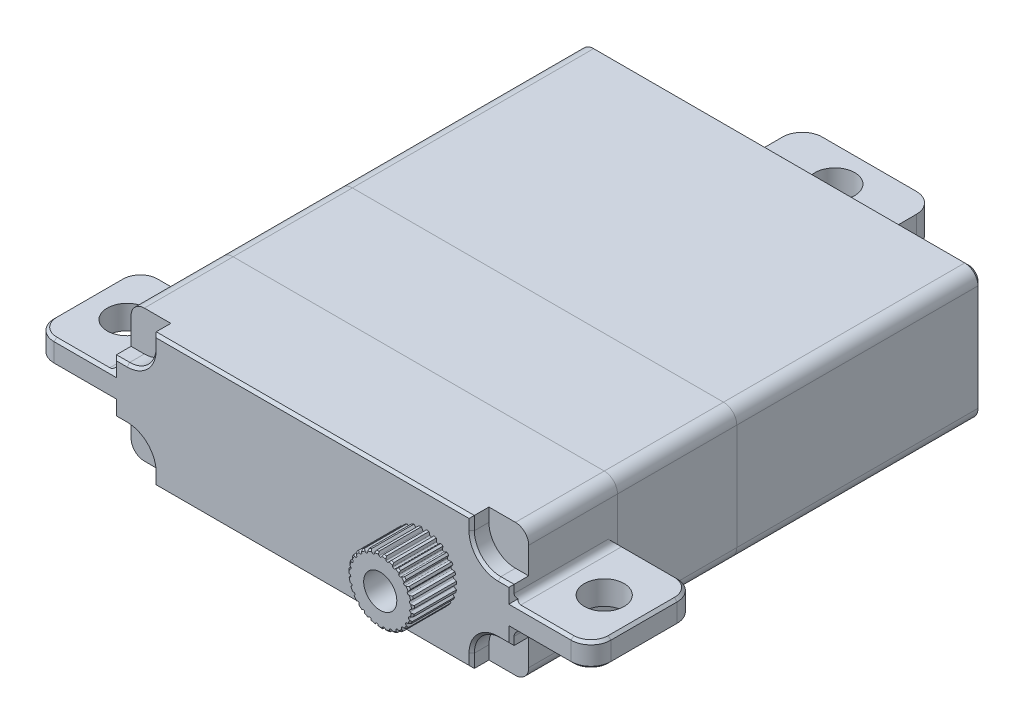
from build123d import *

# Parameters (mm, degrees)
SKETCH1_W                = 30
SKETCH1_H                = 35.5
BOSS_EXTRUDE1_DEPTH      = 10
SKETCH2_W                = 10.1
SKETCH2_H                = 2.1
BOSS_EXTRUDE2_DEPTH      = 6.5
SKETCH3_R                = 1.5
CUT_EXTRUDE1_DEPTH       = 6.5
FILLET1_R                = 1.5
BOSS_EXTRUDE3_DEPTH      = 0.9
BOSS_EXTRUDE3_DEPTH_BACK = 0.9
SKETCH4_W                = 6
SKETCH4_H                = 8
SKETCH4_R                = 1.5
FILLET2_R                = 1.5
SKETCH5_R                = 2.125
BOSS_EXTRUDE4_DEPTH      = 3.3
BOSS_EXTRUDE5_START      = -3.3
SKETCH6_R                = 2.125
BOSS_EXTRUDE5_DEPTH      = 3.3
SKETCH7_R                = 1.25
CUT_EXTRUDE2_DEPTH       = 3.3
CUT_EXTRUDE3_DEPTH       = 1.3
FILLET3_R                = 1
CHAMFER1_SIZE            = 0.3
CHAMFER2_SIZE            = 0.2
FILLET4_R                = 0.5


with BuildPart() as part:
    # Sketch1 → Boss-Extrude1 (new body)
    with BuildSketch(Plane(origin=(0, 0, 0), x_dir=(1, 0, 0), z_dir=(0, 1, 0))):
        Rectangle(SKETCH1_W, SKETCH1_H)
    extrude(amount=BOSS_EXTRUDE1_DEPTH)

    # Sketch2 → Boss-Extrude2 (add)
    with BuildSketch(Plane(origin=(0, 0, -17.75), x_dir=(-1, 0, 0), z_dir=(0, 0, -1))):
        with Locations((0, 5)):
            Rectangle(SKETCH2_W, SKETCH2_H)
    extrude(amount=BOSS_EXTRUDE2_DEPTH)

    # Sketch3 → Cut-Extrude1 (cut)
    with BuildSketch(Plane(origin=(0, 6.05, 0), x_dir=(1, 0, 0), z_dir=(0, 1, 0))):
        with Locations((0, 21.65)):
            Circle(SKETCH3_R)
    extrude(amount=-CUT_EXTRUDE1_DEPTH, mode=Mode.SUBTRACT)

    # Fillet1
    fillet1_edges = [part.edges().sort_by_distance(p)[0] for p in [
        (-5.05, 5, -24.25),
        (5.05, 5, -24.25),
    ]]
    fillet(fillet1_edges, radius=FILLET1_R)

    # Sketch4 → Boss-Extrude3 (add, two sides: drawn at the far end of the back side and taken through both)
    # profile 1 of 2: a face of its own
    with BuildSketch(Plane(origin=(0, 5, 0), x_dir=(1, 0, 0), z_dir=(0, 1, 0)).offset(-BOSS_EXTRUDE3_DEPTH_BACK)):
        with Locations((18, -13.75)):
            Rectangle(SKETCH4_W, SKETCH4_H)
        with Locations((18, -13.75)):
            Circle(SKETCH4_R, mode=Mode.SUBTRACT)
    # profile 2 of 2: a face of its own
    with BuildSketch(Plane(origin=(0, 5, 0), x_dir=(1, 0, 0), z_dir=(0, 1, 0)).offset(-BOSS_EXTRUDE3_DEPTH_BACK)):
        with Locations((-18, -13.75)):
            Rectangle(SKETCH4_W, SKETCH4_H)
        with Locations((-18, -13.75)):
            Circle(SKETCH4_R, mode=Mode.SUBTRACT)
    extrude(amount=BOSS_EXTRUDE3_DEPTH + BOSS_EXTRUDE3_DEPTH_BACK)

    # Fillet2
    fillet2_edges = [part.edges().sort_by_distance(p)[0] for p in [
        (-21, 5, 9.75),
        (-21, 5, 17.75),
        (21, 5, 17.75),
        (21, 5, 9.75),
    ]]
    fillet(fillet2_edges, radius=FILLET2_R)

    # Sketch5 → Boss-Extrude4 (add)
    with BuildSketch(Plane.XY.offset(17.75)):
        with Locations((8.4, 5)):
            Circle(SKETCH5_R)
    extrude(amount=BOSS_EXTRUDE4_DEPTH)

    # Sketch6 → Boss-Extrude5 (add)
    with BuildSketch(Plane.XY.offset(21.05).offset(BOSS_EXTRUDE5_START)):
        with BuildLine():
            Line((8.48660254, 7.275), (8.594746406, 7.46231067))
            ThreePointArc((8.594746406, 7.46231067), (8.686749498, 7.453298744), (8.778350928, 7.44085038))
            Line((8.778350928, 7.44085038), (8.840382948, 7.233649001))
            ThreePointArc((8.840382948, 7.233649001), (8.913120312, 7.165024837), (9.008919264, 7.19370516))
            Line((9.008919264, 7.19370516), (9.157344911, 7.351027155))
            ThreePointArc((9.157344911, 7.351027155), (9.244789754, 7.321040773), (9.331051265, 7.287803213))
            Line((9.331051265, 7.287803213), (9.343627278, 7.071881406))
            ThreePointArc((9.343627278, 7.071881406), (9.398578176, 6.988332625), (9.498408992, 6.994147108))
            Line((9.498408992, 6.994147108), (9.679114756, 7.112999158))
            ThreePointArc((9.679114756, 7.112999158), (9.757287176, 7.063654894), (9.833558388, 7.011419983))
            Line((9.833558388, 7.011419983), (9.796000417, 6.798418148))
            ThreePointArc((9.796000417, 6.798418148), (9.830202432, 6.704448886), (9.928683207, 6.687084068))
            Line((9.928683207, 6.687084068), (10.131927192, 6.761058829))
            ThreePointArc((10.131927192, 6.761058829), (10.196612895, 6.695016846), (10.258782007, 6.626600581))
            Line((10.258782007, 6.626600581), (10.173114812, 6.428001702))
            ThreePointArc((10.173114812, 6.428001702), (10.184724104, 6.328677867), (10.276545715, 6.28906989))
            Line((10.276545715, 6.28906989), (10.491370986, 6.314179363))
            ThreePointArc((10.491370986, 6.314179363), (10.539082747, 6.235), (10.583798207, 6.154090721))
            Line((10.583798207, 6.154090721), (10.454640129, 5.980601315))
            ThreePointArc((10.454640129, 5.980601315), (10.443030838, 5.881277479), (10.523243157, 5.82156162))
            Line((10.523243157, 5.82156162), (10.738068429, 5.796452147))
            ThreePointArc((10.738068429, 5.796452147), (10.766234095, 5.708403985), (10.79108528, 5.619363532))
            Line((10.79108528, 5.619363532), (10.625399265, 5.480336457))
            ThreePointArc((10.625399265, 5.480336457), (10.59119725, 5.386367195), (10.655476011, 5.309762751))
            Line((10.655476011, 5.309762751), (10.858719997, 5.23578799))
            ThreePointArc((10.858719997, 5.23578799), (10.865821151, 5.143617727), (10.869468327, 5.051246294))
            Line((10.869468327, 5.051246294), (10.67618655, 4.954176537))
            ThreePointArc((10.67618655, 4.954176537), (10.621235652, 4.870627756), (10.66611557, 4.781264492))
            Line((10.66611557, 4.781264492), (10.846821334, 4.662412441))
            ThreePointArc((10.846821334, 4.662412441), (10.83247515, 4.571089001), (10.814721697, 4.480366355))
            Line((10.814721697, 4.480366355), (10.604264029, 4.430486971))
            ThreePointArc((10.604264029, 4.430486971), (10.531526665, 4.361862807), (10.554588252, 4.26455832))
            Line((10.554588252, 4.26455832), (10.703013899, 4.107236325))
            ThreePointArc((10.703013899, 4.107236325), (10.667993784, 4.021682978), (10.629796796, 3.9375))
            Line((10.629796796, 3.9375), (10.413509064, 3.9375))
            ThreePointArc((10.413509064, 3.9375), (10.326906523, 3.8875), (10.326906523, 3.7875))
            Line((10.326906523, 3.7875), (10.435050389, 3.60018933))
            ThreePointArc((10.435050389, 3.60018933), (10.381244286, 3.525018278), (10.324662972, 3.451913295))
            Line((10.324662972, 3.451913295), (10.114205304, 3.501792679))
            ThreePointArc((10.114205304, 3.501792679), (10.018406353, 3.473112356), (9.995344765, 3.375807869))
            Line((9.995344765, 3.375807869), (10.057376786, 3.16860649))
            ThreePointArc((10.057376786, 3.16860649), (9.987685396, 3.107870225), (9.915770069, 3.049784346))
            Line((9.915770069, 3.049784346), (9.722488292, 3.146854102))
            ThreePointArc((9.722488292, 3.146854102), (9.622657476, 3.14103962), (9.577777558, 3.051676356))
            Line((9.577777558, 3.051676356), (9.590353571, 2.835754548))
            ThreePointArc((9.590353571, 2.835754548), (9.508533975, 2.792727378), (9.425161609, 2.752792027))
            Line((9.425161609, 2.752792027), (9.259475594, 2.891819101))
            ThreePointArc((9.259475594, 2.891819101), (9.160994819, 2.909183919), (9.096716058, 2.832579474))
            Line((9.096716058, 2.832579474), (9.059158087, 2.619577639))
            ThreePointArc((9.059158087, 2.619577639), (8.969621201, 2.59657917), (8.879286422, 2.576947271))
            Line((8.879286422, 2.576947271), (8.750128345, 2.750436677))
            ThreePointArc((8.750128345, 2.750436677), (8.658306734, 2.790044654), (8.578094415, 2.730328795))
            Line((8.578094415, 2.730328795), (8.49242722, 2.531729916))
            ThreePointArc((8.49242722, 2.531729916), (8.4, 2.53), (8.30757278, 2.531729916))
            Line((8.30757278, 2.531729916), (8.221905585, 2.730328795))
            ThreePointArc((8.221905585, 2.730328795), (8.141693266, 2.790044654), (8.049871655, 2.750436677))
            Line((8.049871655, 2.750436677), (7.920713578, 2.576947271))
            ThreePointArc((7.920713578, 2.576947271), (7.830378799, 2.59657917), (7.740841913, 2.619577639))
            Line((7.740841913, 2.619577639), (7.703283942, 2.832579474))
            ThreePointArc((7.703283942, 2.832579474), (7.639005181, 2.909183919), (7.540524406, 2.891819101))
            Line((7.540524406, 2.891819101), (7.374838391, 2.752792027))
            ThreePointArc((7.374838391, 2.752792027), (7.291466025, 2.792727378), (7.209646429, 2.835754548))
            Line((7.209646429, 2.835754548), (7.222222442, 3.051676356))
            ThreePointArc((7.222222442, 3.051676356), (7.177342524, 3.14103962), (7.077511708, 3.146854102))
            Line((7.077511708, 3.146854102), (6.884229931, 3.049784346))
            ThreePointArc((6.884229931, 3.049784346), (6.812314604, 3.107870225), (6.742623214, 3.16860649))
            Line((6.742623214, 3.16860649), (6.804655235, 3.375807869))
            ThreePointArc((6.804655235, 3.375807869), (6.781593647, 3.473112356), (6.685794696, 3.501792679))
            Line((6.685794696, 3.501792679), (6.475337028, 3.451913295))
            ThreePointArc((6.475337028, 3.451913295), (6.418755714, 3.525018278), (6.364949611, 3.60018933))
            Line((6.364949611, 3.60018933), (6.473093477, 3.7875))
            ThreePointArc((6.473093477, 3.7875), (6.473093477, 3.8875), (6.386490936, 3.9375))
            Line((6.386490936, 3.9375), (6.170203204, 3.9375))
            ThreePointArc((6.170203204, 3.9375), (6.132006216, 4.021682978), (6.096986101, 4.107236325))
            Line((6.096986101, 4.107236325), (6.245411748, 4.26455832))
            ThreePointArc((6.245411748, 4.26455832), (6.268473335, 4.361862807), (6.195735971, 4.430486971))
            Line((6.195735971, 4.430486971), (5.985278303, 4.480366355))
            ThreePointArc((5.985278303, 4.480366355), (5.96752485, 4.571089001), (5.953178666, 4.662412441))
            Line((5.953178666, 4.662412441), (6.13388443, 4.781264492))
            ThreePointArc((6.13388443, 4.781264492), (6.178764348, 4.870627756), (6.12381345, 4.954176537))
            Line((6.12381345, 4.954176537), (5.930531673, 5.051246294))
            ThreePointArc((5.930531673, 5.051246294), (5.934178849, 5.143617727), (5.941280003, 5.23578799))
            Line((5.941280003, 5.23578799), (6.144523989, 5.309762751))
            ThreePointArc((6.144523989, 5.309762751), (6.20880275, 5.386367195), (6.174600735, 5.480336457))
            Line((6.174600735, 5.480336457), (6.00891472, 5.619363532))
            ThreePointArc((6.00891472, 5.619363532), (6.033765905, 5.708403985), (6.061931571, 5.796452147))
            Line((6.061931571, 5.796452147), (6.276756843, 5.82156162))
            ThreePointArc((6.276756843, 5.82156162), (6.356969162, 5.881277479), (6.345359871, 5.980601315))
            Line((6.345359871, 5.980601315), (6.216201793, 6.154090721))
            ThreePointArc((6.216201793, 6.154090721), (6.260917253, 6.235), (6.308629014, 6.314179363))
            Line((6.308629014, 6.314179363), (6.523454285, 6.28906989))
            ThreePointArc((6.523454285, 6.28906989), (6.615275896, 6.328677867), (6.626885188, 6.428001702))
            Line((6.626885188, 6.428001702), (6.541217993, 6.626600581))
            ThreePointArc((6.541217993, 6.626600581), (6.603387105, 6.695016846), (6.668072808, 6.761058829))
            Line((6.668072808, 6.761058829), (6.871316793, 6.687084068))
            ThreePointArc((6.871316793, 6.687084068), (6.969797568, 6.704448886), (7.003999583, 6.798418148))
            Line((7.003999583, 6.798418148), (6.966441612, 7.011419983))
            ThreePointArc((6.966441612, 7.011419983), (7.042712824, 7.063654894), (7.120885244, 7.112999158))
            Line((7.120885244, 7.112999158), (7.301591008, 6.994147108))
            ThreePointArc((7.301591008, 6.994147108), (7.401421824, 6.988332625), (7.456372722, 7.071881406))
            Line((7.456372722, 7.071881406), (7.468948735, 7.287803213))
            ThreePointArc((7.468948735, 7.287803213), (7.555210246, 7.321040773), (7.642655089, 7.351027155))
            Line((7.642655089, 7.351027155), (7.791080736, 7.19370516))
            ThreePointArc((7.791080736, 7.19370516), (7.886879688, 7.165024837), (7.959617052, 7.233649001))
            Line((7.959617052, 7.233649001), (8.021649072, 7.44085038))
            ThreePointArc((8.021649072, 7.44085038), (8.113250502, 7.453298744), (8.205253594, 7.46231067))
            Line((8.205253594, 7.46231067), (8.31339746, 7.275))
            ThreePointArc((8.31339746, 7.275), (8.4, 7.225), (8.48660254, 7.275))
        make_face()
        with Locations((8.4, 5)):
            Circle(SKETCH6_R, mode=Mode.SUBTRACT)
    extrude(amount=BOSS_EXTRUDE5_DEPTH)

    # Sketch7 → Cut-Extrude2 (cut)
    with BuildSketch(Plane.XY.offset(21.05)):
        with Locations((8.4, 5)):
            Circle(SKETCH7_R)
    extrude(amount=-CUT_EXTRUDE2_DEPTH, mode=Mode.SUBTRACT)

    # Sketch8 → Cut-Revolve1 (revolve, cut)
    with BuildSketch(Plane(origin=(0, 5, 0), x_dir=(1, 0, 0), z_dir=(0, 1, 0))):
        Polygon((10.636406398, -21.139898599), (10.920575788, -20.90376548), (10.920575788, -21.139898599), align=None)
    revolve(axis=Axis((8.4, 5, 21.05), (0, 0, -1)), mode=Mode.SUBTRACT)

    # Sketch10 → Cut-Extrude3 (cut)
    with BuildSketch(Plane.XY.offset(17.75)):
        with BuildLine():
            Line((15, 10), (15, 7))
            Line((15, 7), (14, 7))
            ThreePointArc((14, 7), (12.585786438, 7.585786438), (12, 9))
            Line((12, 9), (12, 10))
            Line((12, 10), (15, 10))
        make_face()
        with BuildLine():
            Line((-14, 7), (-15, 7))
            Line((-15, 7), (-15, 10))
            Line((-15, 10), (-12, 10))
            Line((-12, 10), (-12, 9))
            ThreePointArc((-12, 9), (-12.585786438, 7.585786438), (-14, 7))
        make_face()
        with BuildLine():
            Line((-15, 0), (-15, 3))
            Line((-15, 3), (-14, 3))
            ThreePointArc((-14, 3), (-12.585786438, 2.414213562), (-12, 1))
            Line((-12, 1), (-12, 0))
            Line((-12, 0), (-15, 0))
        make_face()
        with BuildLine():
            Line((14, 3), (15, 3))
            Line((15, 3), (15, 0))
            Line((15, 0), (12, 0))
            Line((12, 0), (12, 1))
            ThreePointArc((12, 1), (12.585786438, 2.414213562), (14, 3))
        make_face()
    extrude(amount=-CUT_EXTRUDE3_DEPTH, mode=Mode.SUBTRACT)

    # Fillet3
    fillet3_edges = [part.edges().sort_by_distance(p)[0] for p in [
        (15, 10, -0.65),
        (-15, 10, -0.65),
        (15, 0, -0.65),
        (-15, 0, -0.65),
    ]]
    fillet(fillet3_edges, radius=FILLET3_R)

    # Chamfer1
    chamfer1_edges = [part.edges().sort_by_distance(p)[0] for p in [
        (-14.707106781, 0.292893219, -17.75),
        (-15, 5, -17.75),
        (-14.707106781, 9.707106781, -17.75),
        (0, 10, -17.75),
        (14.707106781, 9.707106781, -17.75),
        (15, 5, -17.75),
        (14.707106781, 0.292893219, -17.75),
        (0, 0, -17.75),
    ]]
    chamfer(chamfer1_edges, length=CHAMFER1_SIZE)

    # Chamfer2
    chamfer2_edges = [part.edges().sort_by_distance(p)[0] for p in [
        (-17.25, 5.9, 9.75),
        (17.25, 5.9, 9.75),
        (-20.560660172, 5.9, 10.189339828),
        (20.560660172, 5.9, 10.189339828),
        (-21, 5.9, 13.75),
        (21, 5.9, 13.75),
        (-20.560660172, 5.9, 17.310660172),
        (20.560660172, 5.9, 17.310660172),
        (-17.25, 5.9, 17.75),
        (-15, 6.45, 17.75),
        (-14.5, 7, 17.75),
        (-12.585786438, 7.585786438, 17.75),
        (-12, 9.5, 17.75),
        (0, 10, 17.75),
        (12, 9.5, 17.75),
        (12.585786438, 7.585786438, 17.75),
        (14.5, 7, 17.75),
        (15, 6.45, 17.75),
        (17.25, 5.9, 17.75),
        (-17.25, 4.1, 9.75),
        (17.25, 4.1, 9.75),
        (-20.560660172, 4.1, 10.189339828),
        (20.560660172, 4.1, 10.189339828),
        (-21, 4.1, 13.75),
        (21, 4.1, 13.75),
        (-20.560660172, 4.1, 17.310660172),
        (20.560660172, 4.1, 17.310660172),
        (-17.25, 4.1, 17.75),
        (-15, 3.55, 17.75),
        (-14.5, 3, 17.75),
        (-12.585786438, 2.414213562, 17.75),
        (-12, 0.5, 17.75),
        (0, 0, 17.75),
        (12, 0.5, 17.75),
        (17.25, 4.1, 17.75),
        (15, 3.55, 17.75),
        (14.5, 3, 17.75),
        (12.585786438, 2.414213562, 17.75),
    ]]
    chamfer(chamfer2_edges, length=CHAMFER2_SIZE)

    # Fillet4
    fillet4_edges = [part.edges().sort_by_distance(p)[0] for p in [
        (-15, 4.1, 13.75),
        (-15, 5.9, 13.75),
        (15, 5.9, 13.75),
        (15, 4.1, 13.75),
    ]]
    fillet(fillet4_edges, radius=FILLET4_R)


solid = part.part
